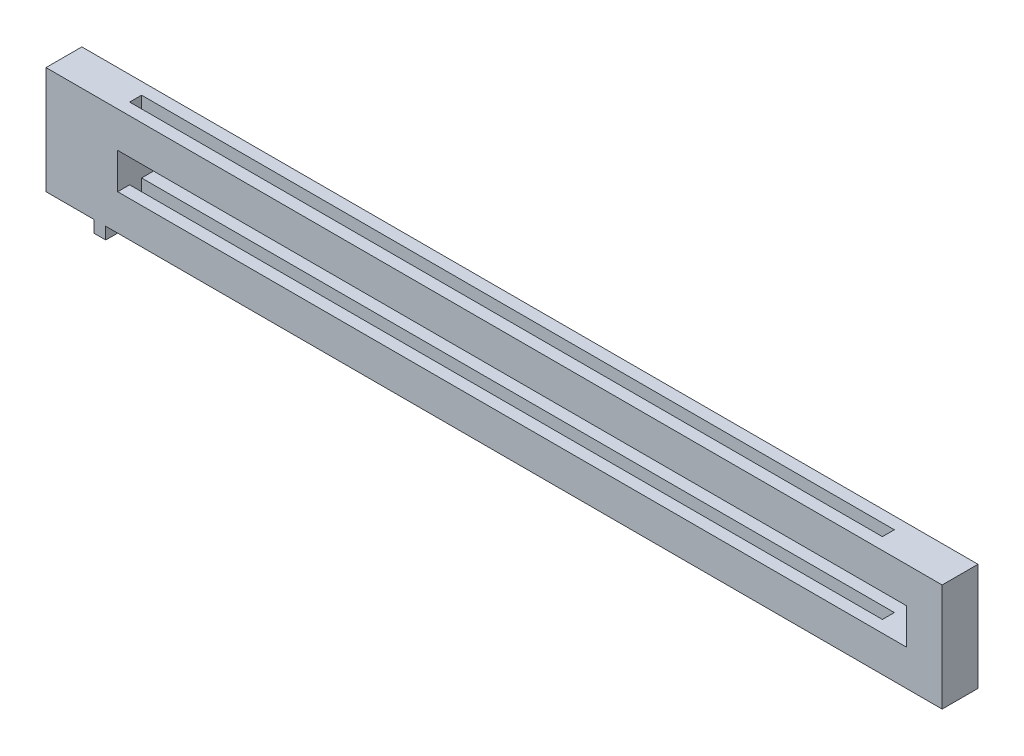
from build123d import *

# Parameters (mm, degrees)
SKETCH1_W              = 120
SKETCH1_H              = 15
SKETCH1_W_2            = 110
SKETCH1_H_2            = 5
SLIDER_MAIN_BODY_DEPTH = 5
SKETCH2_W              = 1.666666666
SKETCH2_H              = 5
TRACK_SLIDER_DEPTH     = 1.666666667
SKETCH3_W              = 5
SKETCH3_H              = 15
HANDLE_DEPTH           = 5
SKETCH5_W              = 105
SKETCH5_H              = 1.666666666
CUT_EXTRUDE1_DEPTH     = 67.895440801


with BuildPart() as part:
    # Sketch1 → Slider Main Body (new body)
    with BuildSketch(Plane.XY):
        Rectangle(SKETCH1_W, SKETCH1_H)
        Rectangle(SKETCH1_W_2, SKETCH1_H_2, mode=Mode.SUBTRACT)
    extrude(amount=SLIDER_MAIN_BODY_DEPTH)

    # Sketch2 → Track Slider (add)
    with BuildSketch(Plane.XZ.offset(7.5)):
        with Locations((-57.5, 2.5)):
            Rectangle(SKETCH2_W, SKETCH2_H)
    extrude(amount=TRACK_SLIDER_DEPTH)

    # Sketch3 → Handle (add)
    with BuildSketch(Plane.XY.offset(5)):
        with Locations((-62.5, 0)):
            Rectangle(SKETCH3_W, SKETCH3_H)
    extrude(amount=-HANDLE_DEPTH)

    # Sketch5 → Cut-Extrude1 (cut, through all)
    with BuildSketch(Plane.XZ.offset(7.5)):
        with Locations((-2.5, 2.5)):
            Rectangle(SKETCH5_W, SKETCH5_H)
    extrude(amount=-CUT_EXTRUDE1_DEPTH, mode=Mode.SUBTRACT)


solid = part.part
